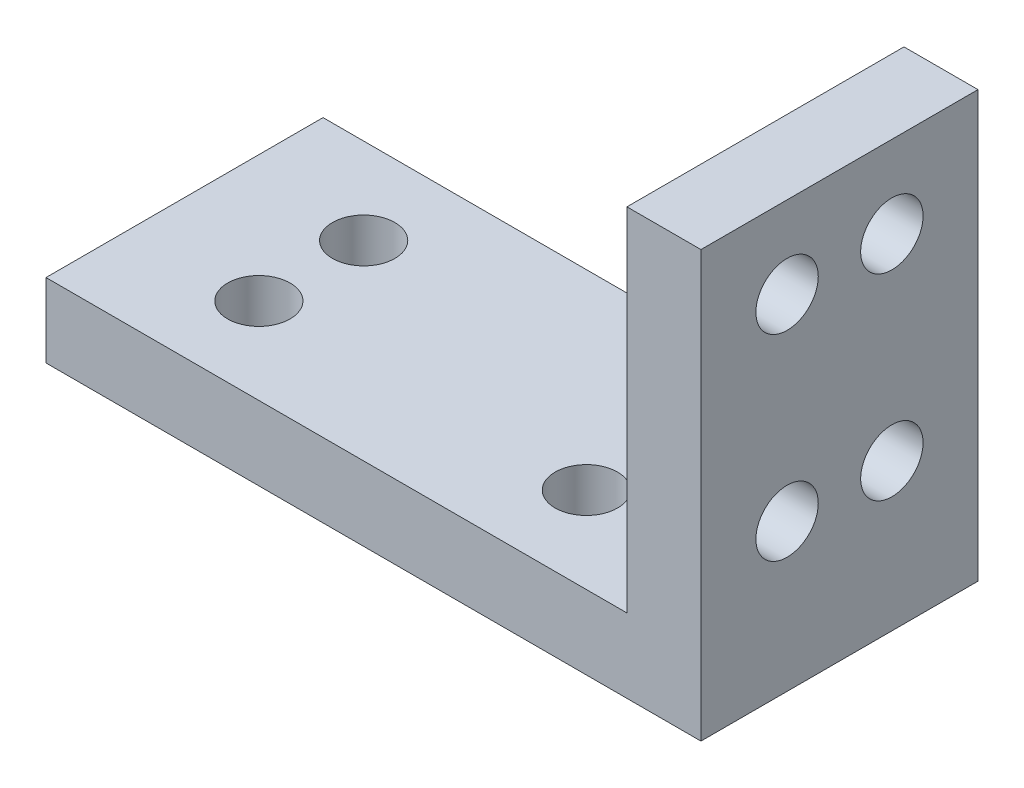
from build123d import *

# Parameters (mm, degrees)
SKETCH1_W           = 100
SKETCH1_H           = 42.3
BOSS_EXTRUDE1_DEPTH = 11.3
SKETCH2_W           = 11.3
SKETCH2_H           = 42.3
BOSS_EXTRUDE2_DEPTH = 53.7
SKETCH3_R           = 4.7625
CUT_EXTRUDE1_DEPTH  = 53.7
SKETCH4_R           = 4.7625
CUT_EXTRUDE2_DEPTH  = 53.7


with BuildPart() as part:
    # Sketch1 → Boss-Extrude1 (new body)
    with BuildSketch(Plane(origin=(0, 0, 0), x_dir=(1, 0, 0), z_dir=(0, 1, 0))):
        with Locations((50, -21.15)):
            Rectangle(SKETCH1_W, SKETCH1_H)
    extrude(amount=BOSS_EXTRUDE1_DEPTH)

    # Sketch2 → Boss-Extrude2 (add)
    with BuildSketch(Plane(origin=(0, 11.3, 0), x_dir=(1, 0, 0), z_dir=(0, 1, 0))):
        with Locations((94.35, -21.15)):
            Rectangle(SKETCH2_W, SKETCH2_H)
    extrude(amount=BOSS_EXTRUDE2_DEPTH)

    # Sketch3 → Cut-Extrude1 (cut)
    with BuildSketch(Plane(origin=(100, 0, 0), x_dir=(0, 0, -1), z_dir=(1, 0, 0))):
        with Locations((-13.15, 22.5)):
            Circle(SKETCH3_R)
        with Locations((-13.15, 52.5)):
            Circle(SKETCH3_R)
        with Locations((-29.15, 52.5)):
            Circle(SKETCH3_R)
        with Locations((-29.15, 22.5)):
            Circle(SKETCH3_R)
    extrude(amount=-CUT_EXTRUDE1_DEPTH, mode=Mode.SUBTRACT)

    # Sketch4 → Cut-Extrude2 (cut)
    with BuildSketch(Plane(origin=(0, 11.3, 0), x_dir=(1, 0, 0), z_dir=(0, 1, 0))):
        with Locations(Location((19.35, -13.15, 0), (0, 0, 270))):
            Circle(SKETCH4_R)
        with Locations(Location((69.35, -13.15, 0), (0, 0, 270))):
            Circle(SKETCH4_R)
        with Locations(Location((19.35, -29.15, 0), (0, 0, 270))):
            Circle(SKETCH4_R)
        with Locations(Location((69.35, -29.15, 0), (0, 0, 270))):
            Circle(SKETCH4_R)
    extrude(amount=-CUT_EXTRUDE2_DEPTH, mode=Mode.SUBTRACT)


solid = part.part
